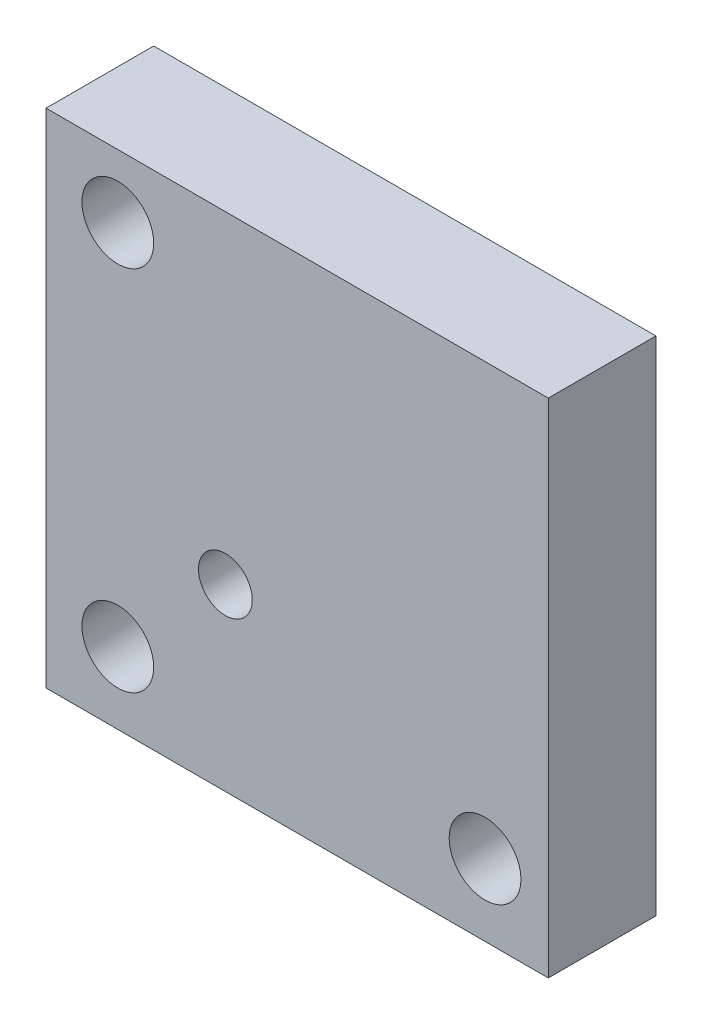
from build123d import *

# Parameters (mm, degrees)
SKETCH1_W                  = 44.45
SKETCH1_H                  = 44.45
BOSS_EXTRUDE1_DEPTH        = 9.525
CBORE_FOR_1_4_1_AT_2_COUNT = 2
CBORE_FOR_1_4_1_AT_2_PITCH = 45.963472584
CBORE_FOR_1_4_1_AT_3_COUNT = 2
CBORE_FOR_1_4_1_AT_3_PITCH = 32.501083151
SKETCH6_R                  = 6.35
CUT_EXTRUDE1_DEPTH         = 4.7752
SKETCH7_R                  = 2.38125
CUT_EXTRUDE2_DEPTH         = 33.842455374


with BuildPart() as part:
    # Sketch1 → Boss-Extrude1 (new body)
    with BuildSketch(Plane.XY):
        Rectangle(SKETCH1_W, SKETCH1_H)
    extrude(amount=BOSS_EXTRUDE1_DEPTH)

    # Sketch5 → CBORE for 1/4 _1 (revolve, cut)
    with BuildSketch(Plane(origin=(-15.875, 16.626083151, 0), x_dir=(0, 1, 0), z_dir=(1, 0, 0))):
        Polygon((0, 0), (0, 9.525), (3.175, 9.525), (3.175, 0.508), (3.81, 0.508), (3.81, 0.127), (3.937, 0), align=None)
    cbore_for_1_4_1 = revolve(axis=Axis((-15.875, 16.626083151, -6.35), (0, 0, 1)), mode=Mode.SUBTRACT)

    # CBORE for 1/4 _1 at 2: CBORE for 1/4 _1 ×2
    with Locations(*[Vector(0.7071067811865476, -0.7071067811865476, 0) * (i * CBORE_FOR_1_4_1_AT_2_PITCH) for i in range(1, CBORE_FOR_1_4_1_AT_2_COUNT)]):
        add(cbore_for_1_4_1, mode=Mode.SUBTRACT)

    # CBORE for 1/4 _1 at 3: CBORE for 1/4 _1 ×2
    with Locations(*[(0, -i * CBORE_FOR_1_4_1_AT_3_PITCH, 0) for i in range(1, CBORE_FOR_1_4_1_AT_3_COUNT)]):
        add(cbore_for_1_4_1, mode=Mode.SUBTRACT)

    # Sketch6 → Cut-Extrude1 (cut)
    with BuildSketch(Plane(origin=(0, 0, 0), x_dir=(-1, 0, 0), z_dir=(0, 0, -1))):
        with Locations((6.355653141, -6.355653141)):
            Circle(SKETCH6_R)
    extrude(amount=-CUT_EXTRUDE1_DEPTH, mode=Mode.SUBTRACT)

    # Sketch7 → Cut-Extrude2 (cut, through all)
    with BuildSketch(Plane(origin=(0, 0, 0), x_dir=(-1, 0, 0), z_dir=(0, 0, -1))):
        with Locations((6.355653141, -6.355653141)):
            Circle(SKETCH7_R)
    extrude(amount=-CUT_EXTRUDE2_DEPTH, mode=Mode.SUBTRACT)


solid = part.part
